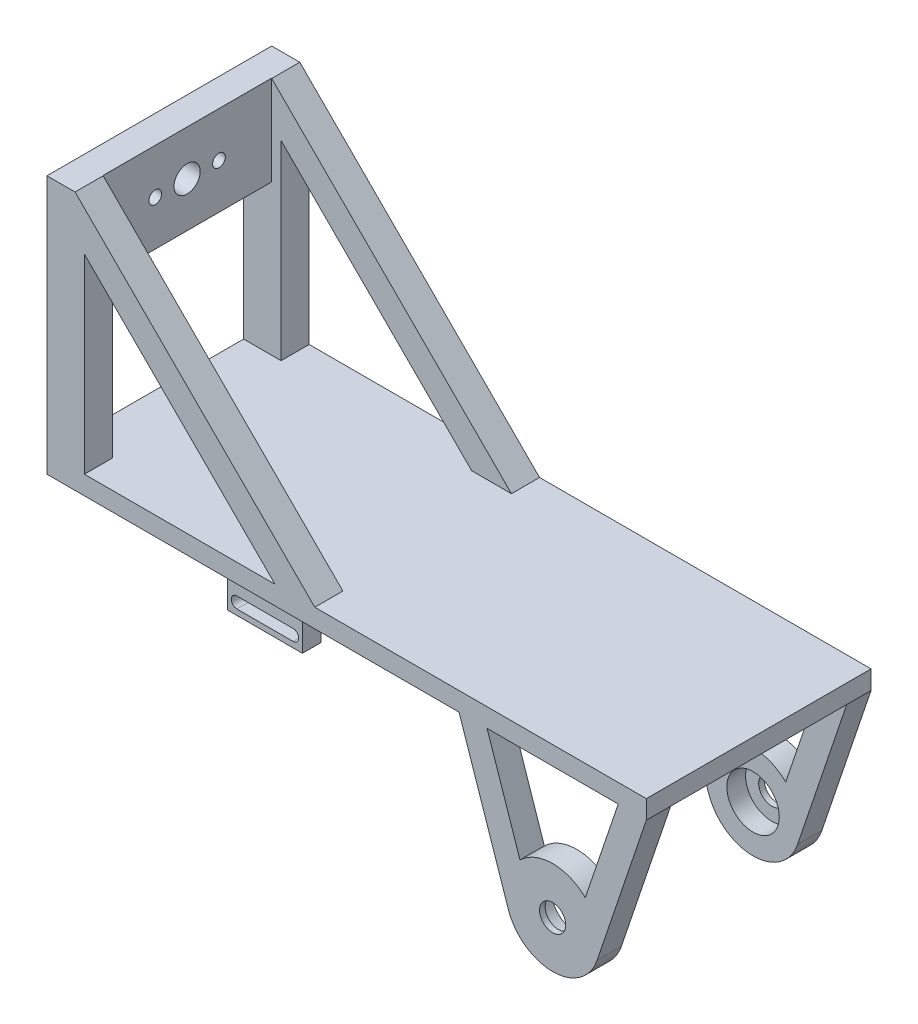
from build123d import *

# Parameters (mm, degrees)
SKETCH1_W                = 160
SKETCH1_H                = 60
BOSS_EXTRUDE1_DEPTH      = 5
BOSS_EXTRUDE3_DEPTH      = 14.3
BOSS_EXTRUDE3_DEPTH_BACK = 14.3
SKETCH8_W                = 20
SKETCH8_H                = 23
CUT_EXTRUDE1_REACH       = 134.986
BOSS_EXTRUDE4_DEPTH      = 60
CUT_EXTRUDE2_START       = -71.5
SKETCH11_W               = 45
SKETCH11_H               = 40
CUT_EXTRUDE2_DEPTH       = 71.5
SKETCH12_W               = 24.082620142
SKETCH12_H               = 45
CUT_EXTRUDE3_DEPTH       = 24
SKETCH13_R               = 3.5
SKETCH13_R_2             = 1.7
CUT_EXTRUDE4_DEPTH       = 7.417379858
SKETCH14_R               = 3.5
BOSS_EXTRUDE5_DEPTH      = 60
SKETCH16_W               = 47
SKETCH16_H               = 47.898935067
CUT_EXTRUDE6_DEPTH       = 107.5
CUT_EXTRUDE7_DEPTH       = 28.5
CUT_EXTRUDE7_DEPTH_BACK  = 28.5
SKETCH17_R               = 7


with BuildPart() as part:
    # Sketch1 → Boss-Extrude1 (new body)
    with BuildSketch(Plane(origin=(0, 0, 0), x_dir=(1, 0, 0), z_dir=(0, 1, 0))):
        Rectangle(SKETCH1_W, SKETCH1_H)
    extrude(amount=BOSS_EXTRUDE1_DEPTH)

    # Sketch8 → Boss-Extrude3 (add, two sides: drawn at the far end of the back side and taken through both)
    with BuildSketch(Plane.XY.offset(-BOSS_EXTRUDE3_DEPTH_BACK)):
        with Locations((-37.5, -11.5)):
            Rectangle(SKETCH8_W, SKETCH8_H)
        with BuildLine():
            Line((-45, -18.5), (-30, -18.5))
            ThreePointArc((-30, -18.5), (-28.5, -20), (-30, -21.5))
            Line((-30, -21.5), (-45, -21.5))
            ThreePointArc((-45, -21.5), (-46.5, -20), (-45, -18.5))
        make_face(mode=Mode.SUBTRACT)
        with BuildLine():
            Line((-45, -0.9), (-30, -0.9))
            ThreePointArc((-30, -0.9), (-28.5, -2.4), (-30, -3.9))
            Line((-30, -3.9), (-45, -3.9))
            ThreePointArc((-45, -3.9), (-46.5, -2.4), (-45, -0.9))
        make_face(mode=Mode.SUBTRACT)
    extrude(amount=BOSS_EXTRUDE3_DEPTH + BOSS_EXTRUDE3_DEPTH_BACK)

    # Cut-Extrude1: up to this face of the body (flat: up to its plane)
    cut_extrude1_end = Plane(part.part.faces().sort_by_distance((-27.5, -11.5, 0))[0])
    # Sketch9 → Cut-Extrude1 (cut, up to the picked face)
    with BuildSketch(Plane.ZY.offset(47.5), mode=Mode.PRIVATE) as cut_extrude1_sk1:
        Polygon((-9.3, -23), (9.3, -23), (9.3, 0), (-9.3, 0), (-9.3, -9.4), (-11.3, -9.4), (-11.3, -13.4), (-9.3, -13.4), align=None)
    cut_extrude1_tool1 = split(extrude(cut_extrude1_sk1.sketch, amount=-CUT_EXTRUDE1_REACH, mode=Mode.PRIVATE), bisect_by=cut_extrude1_end, keep=Keep.BOTH, mode=Mode.PRIVATE)
    add(cut_extrude1_tool1.solids().sort_by(Axis((-47.5, -11.498164, -0.189078), (1, 0, 0)))[0], mode=Mode.SUBTRACT)

    # Sketch10 → Boss-Extrude4 (add)
    with BuildSketch(Plane.XY.offset(30)):
        Polygon((-72.5, 69), (-8.5, 5), (-19.106601718, 5), (-70, 55.893398282), (-70, 5), (-72.5, 5), (-80, 5), (-80, 69), align=None)
    extrude(amount=-BOSS_EXTRUDE4_DEPTH)

    # Sketch11 → Cut-Extrude2 (cut)
    with BuildSketch(Plane.ZY.offset(80).offset(CUT_EXTRUDE2_START)):
        with Locations((0, 25)):
            Rectangle(SKETCH11_W, SKETCH11_H)
    extrude(amount=CUT_EXTRUDE2_DEPTH, mode=Mode.SUBTRACT)

    # Sketch12 → Cut-Extrude3 (cut)
    with BuildSketch(Plane(origin=(0, 69, 0), x_dir=(1, 0, 0), z_dir=(0, 1, 0))):
        with Locations((-60.541310071, 0)):
            Rectangle(SKETCH12_W, SKETCH12_H)
    extrude(amount=-CUT_EXTRUDE3_DEPTH, mode=Mode.SUBTRACT)

    # Sketch13 → Cut-Extrude4 (cut)
    with BuildSketch(Plane.ZY.offset(80)):
        with Locations((0, 57)):
            Circle(SKETCH13_R)
        with Locations((-8.5, 57)):
            Circle(SKETCH13_R_2)
        with Locations((8.5, 57)):
            Circle(SKETCH13_R_2)
    extrude(amount=-CUT_EXTRUDE4_DEPTH, mode=Mode.SUBTRACT)

    # Sketch14 → Boss-Extrude5 (add)
    with BuildSketch(Plane.XY.offset(30)):
        with BuildLine():
            Line((80, 0), (66.844135363, -38.995809861))
            ThreePointArc((66.844135363, -38.995809861), (55, -47.500001557), (43.155864637, -38.995809861))
            Line((43.155864637, -38.995809861), (30, 0))
            Line((30, 0), (37.5, 0))
            Line((37.5, 0), (46.28476615, -26.03926689))
            ThreePointArc((46.28476615, -26.03926689), (55, -22.499998443), (63.71523385, -26.03926689))
            Line((63.71523385, -26.03926689), (72.5, 0))
            Line((72.5, 0), (80, 0))
        make_face()
        with Locations((55, -35)):
            Circle(SKETCH14_R, mode=Mode.SUBTRACT)
    extrude(amount=-BOSS_EXTRUDE5_DEPTH)

    # Sketch16 → Cut-Extrude6 (cut)
    with BuildSketch(Plane(origin=(80, 0, 0), x_dir=(0, 0, -1), z_dir=(1, 0, 0))):
        with Locations((0, -23.949467534)):
            Rectangle(SKETCH16_W, SKETCH16_H)
    extrude(amount=-CUT_EXTRUDE6_DEPTH, mode=Mode.SUBTRACT)

    # Sketch17 → Cut-Extrude7 (cut, two sides: drawn at the far end of the back side and taken through both)
    with BuildSketch(Plane.XY.offset(-CUT_EXTRUDE7_DEPTH_BACK)):
        with Locations((55, -35)):
            Circle(SKETCH17_R)
    extrude(amount=CUT_EXTRUDE7_DEPTH + CUT_EXTRUDE7_DEPTH_BACK, mode=Mode.SUBTRACT)


solid = part.part
